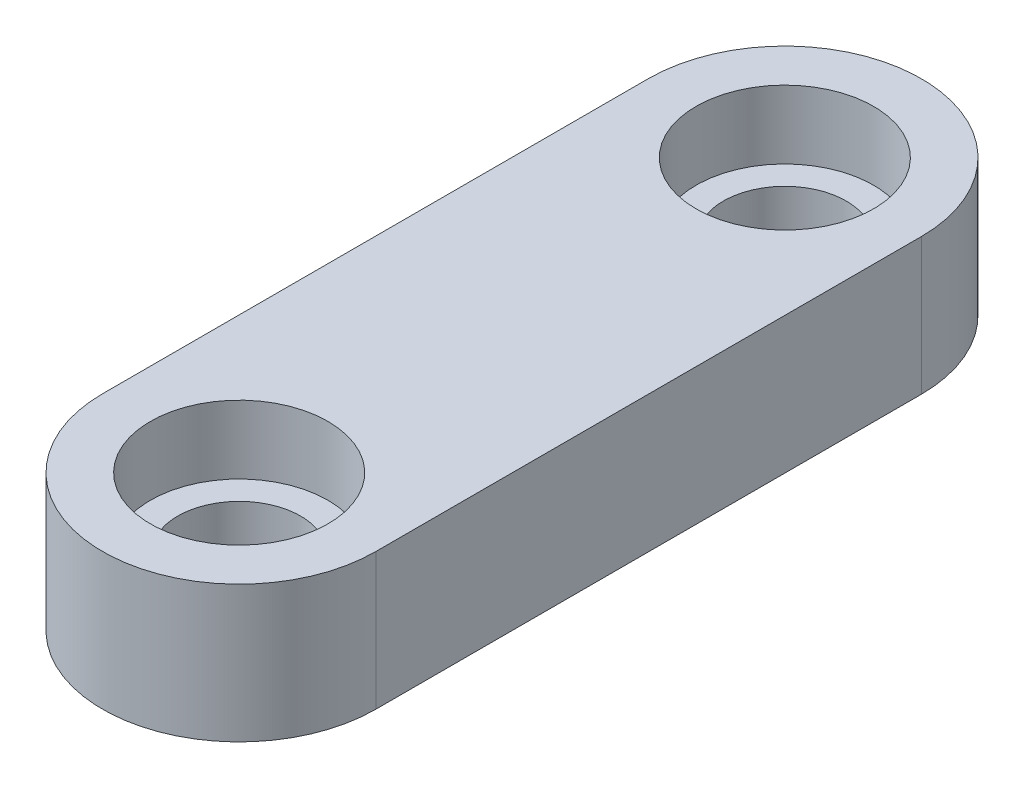
from build123d import *

# Parameters (mm, degrees)
SKETCH_1_W          = 20
SKETCH_1_H          = 10
EXTRUDE_1_DEPTH     = 59.939609738
SKETCH_2_R          = 6.5
CUT_EXTRUDE_1_DEPTH = 5
SKETCH_3_R          = 4.5
CUT_EXTRUDE_2_DEPTH = 20
CUT_EXTRUDE_3_DEPTH = 10
EXTRUDE_2_DEPTH     = 5
SKETCH_5_W          = 3.108428341
SKETCH_5_H          = 8
CUT_EXTRUDE_4_DEPTH = 8
SKETCH_7_R          = 1.25
CUT_EXTRUDE_5_DEPTH = 8


with BuildPart() as part:
    # 스케치1 → 보스-돌출1 (new body)
    with BuildSketch(Plane.XY):
        Rectangle(SKETCH_1_W, SKETCH_1_H)
    extrude(amount=EXTRUDE_1_DEPTH)

    # 스케치2 → 컷-돌출1 (cut)
    with BuildSketch(Plane(origin=(0, 5, 0), x_dir=(1, 0, 0), z_dir=(0, 1, 0))):
        with Locations((0, -10)):
            Circle(SKETCH_2_R)
    cut_extrude_1 = extrude(amount=-CUT_EXTRUDE_1_DEPTH, mode=Mode.SUBTRACT)

    # 스케치3 → 컷-돌출2 (cut)
    with BuildSketch(Plane(origin=(0, 5, 0), x_dir=(1, 0, 0), z_dir=(0, 1, 0))):
        with Locations((0, -10)):
            Circle(SKETCH_3_R)
    cut_extrude_2 = extrude(amount=-CUT_EXTRUDE_2_DEPTH, mode=Mode.SUBTRACT)

    # 스케치3<4> → 컷-돌출3 (cut)
    with BuildSketch(Plane(origin=(0, 5, 0), x_dir=(1, 0, 0), z_dir=(0, 1, 0))):
        with BuildLine():
            Line((-10, 0), (-10, -10))
            ThreePointArc((-10, -10), (-7.071067806, -2.928932182), (1.6e-08, 0))
            Line((1.6e-08, 0), (-10, 0))
        make_face()
        with BuildLine():
            Line((10, 0), (1.6e-08, 0))
            ThreePointArc((1.6e-08, 0), (7.071067818, -2.928932194), (10, -10))
            Line((10, -10), (10, 0))
        make_face()
    cut_extrude_3 = extrude(amount=-CUT_EXTRUDE_3_DEPTH, mode=Mode.SUBTRACT)

    # 대칭 복사1: 컷-돌출1, 컷-돌출2, 컷-돌출3 across plane
    add(cut_extrude_1.mirror(Plane.XY.offset(29.969804869)), mode=Mode.SUBTRACT)
    add(cut_extrude_2.mirror(Plane.XY.offset(29.969804869)), mode=Mode.SUBTRACT)
    add(cut_extrude_3.mirror(Plane.XY.offset(29.969804869)), mode=Mode.SUBTRACT)

    # 스케치4 → 보스-돌출2 (add)
    with BuildSketch(Plane(origin=(0, -5, 0), x_dir=(1, 0, 0), z_dir=(0, 1, 0))):
        Polygon((-2.475489913, -38.118080125), (-10, -33.773802201), (-10, -29.747626971), (0, -29.747626971), (0, -33.840387137), (-2.475489913, -33.840387137), align=None)
    extrude(amount=-EXTRUDE_2_DEPTH)

    # 스케치5 → 컷-돌출4 (cut)
    with BuildSketch(Plane.XZ.offset(5)):
        with Locations((-5.44578583, 25.747626971)):
            Rectangle(SKETCH_5_W, SKETCH_5_H)
    extrude(amount=-CUT_EXTRUDE_4_DEPTH, mode=Mode.SUBTRACT)

    # 스케치7 → 컷-돌출5 (cut)
    with BuildSketch(Plane(origin=(-7, 0, 0), x_dir=(0, 0, -1), z_dir=(1, 0, 0))):
        with Locations((-23.689322855, -1)):
            Circle(SKETCH_7_R)
        with Locations((-27.805931086, -1)):
            Circle(SKETCH_7_R)
    extrude(amount=-CUT_EXTRUDE_5_DEPTH, mode=Mode.SUBTRACT)


solid = part.part
